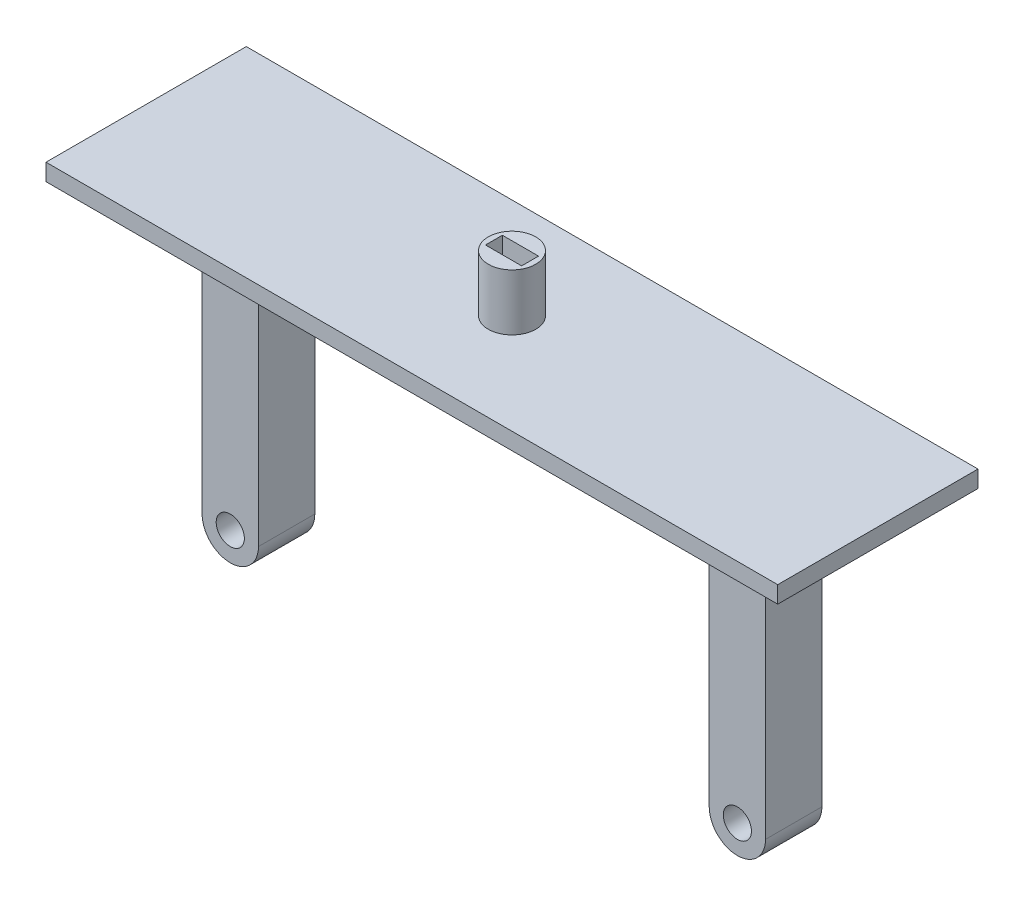
from build123d import *

# Parameters (mm, degrees)
SKETCH1_R           = 2.5
BOSS_EXTRUDE1_DEPTH = 5
SKETCH2_W           = 129.866808808
SKETCH2_H           = 35.545574104
BOSS_EXTRUDE2_DEPTH = 3
SKETCH3_W           = 6.42
SKETCH3_H           = 3
CUT_EXTRUDE1_DEPTH  = 89.860671656
SKETCH4_R           = 4.209133058
SKETCH4_W           = 6.42
SKETCH4_H           = 3
BOSS_EXTRUDE3_DEPTH = 10


with BuildPart() as part:
    # Sketch1 → Boss-Extrude1 (new, symmetric)
    with BuildSketch(Plane.XY):
        with BuildLine():
            Line((50, -1.5), (55, -1.5))
            Line((55, -1.5), (55, 1.5))
            Line((55, 1.5), (-55, 1.5))
            Line((-55, 1.5), (-55, -1.5))
            Line((-55, -1.5), (-50, -1.5))
            Line((-50, -1.5), (-50, -51.5))
            ThreePointArc((-50, -51.5), (-45, -56.5), (-40, -51.5))
            Line((-40, -51.5), (-40, -1.5))
            Line((-40, -1.5), (40, -1.5))
            Line((40, -1.5), (40, -51.5))
            ThreePointArc((40, -51.5), (45, -56.5), (50, -51.5))
            Line((50, -51.5), (50, -1.5))
        make_face()
        with Locations((-45, -51.5)):
            Circle(SKETCH1_R, mode=Mode.SUBTRACT)
        with Locations((45, -51.5)):
            Circle(SKETCH1_R, mode=Mode.SUBTRACT)
    extrude(amount=BOSS_EXTRUDE1_DEPTH, both=True)

    # Sketch2 → Boss-Extrude2 (add)
    with BuildSketch(Plane(origin=(0, 1.5, 0), x_dir=(1, 0, 0), z_dir=(0, 1, 0))):
        Rectangle(SKETCH2_W, SKETCH2_H)
    extrude(amount=-BOSS_EXTRUDE2_DEPTH)

    # Sketch3 → Cut-Extrude1 (cut, through all)
    with BuildSketch(Plane(origin=(0, 1.5, 0), x_dir=(1, 0, 0), z_dir=(0, 1, 0))):
        Rectangle(SKETCH3_W, SKETCH3_H)
    extrude(amount=-CUT_EXTRUDE1_DEPTH, mode=Mode.SUBTRACT)

    # Sketch4 → Boss-Extrude3 (add)
    with BuildSketch(Plane(origin=(0, 1.5, 0), x_dir=(1, 0, 0), z_dir=(0, 1, 0))):
        Circle(SKETCH4_R)
        Rectangle(SKETCH4_W, SKETCH4_H, mode=Mode.SUBTRACT)
    extrude(amount=BOSS_EXTRUDE3_DEPTH)


solid = part.part
